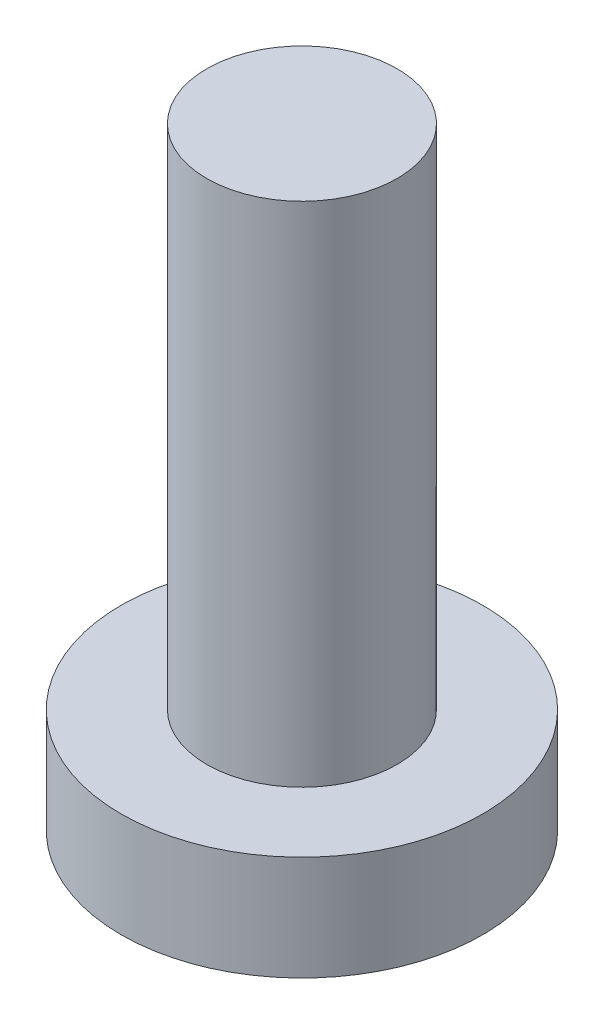
from build123d import *

# Parameters (mm, degrees)
SKETCH_1_R      = 2.85
EXTRUDE_1_DEPTH = 1.65
SKETCH_2_R      = 1.5
EXTRUDE_2_DEPTH = 8


with BuildPart() as part:
    # 草图1 → 凸台-拉伸1 (new body)
    with BuildSketch(Plane(origin=(0, 0, 0), x_dir=(1, 0, 0), z_dir=(0, 1, 0))):
        with Locations(Location((0, 0, 0), (0, 0, 270))):
            Circle(SKETCH_1_R)
    extrude(amount=EXTRUDE_1_DEPTH)

    # 草图2 → 凸台-拉伸2 (add)
    with BuildSketch(Plane(origin=(0, 1.65, 0), x_dir=(1, 0, 0), z_dir=(0, 1, 0))):
        with Locations(Location((0, 0, 0), (0, 0, 270))):
            Circle(SKETCH_2_R)
    extrude(amount=EXTRUDE_2_DEPTH)


solid = part.part
